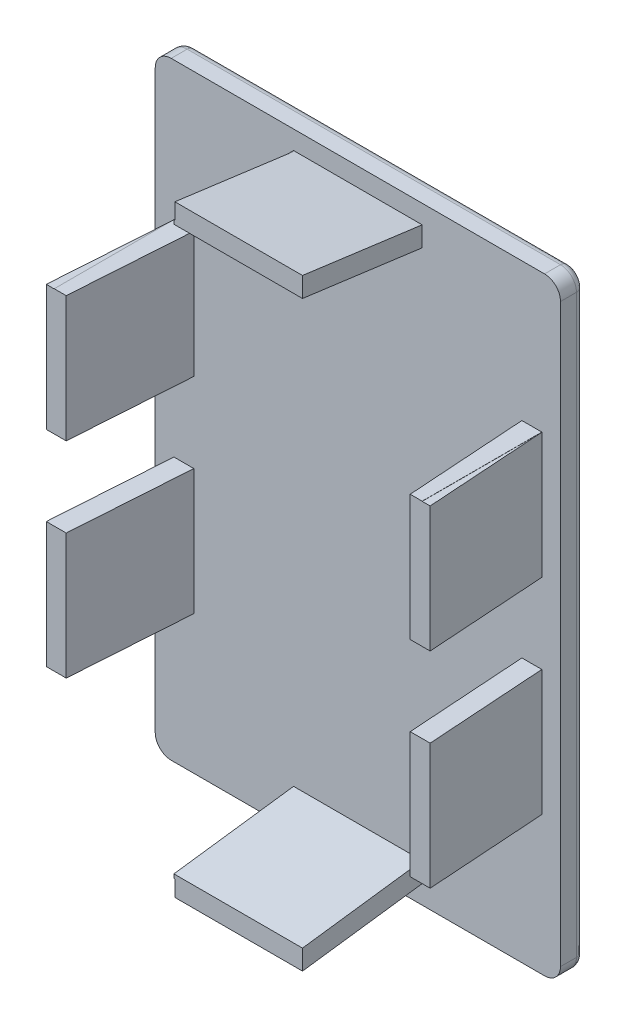
from build123d import *

# Parameters (mm, degrees)
CROQUIS1_W              = 50.8
CROQUIS1_H              = 76.2
SALIENTE_EXTRUIR1_DEPTH = 18
CROQUIS2_W              = 50.8
CROQUIS2_H              = 76.2
CROQUIS2_W_2            = 46.12
CROQUIS2_H_2            = 71.52
CROQUIS2_W_3            = 38.8
CROQUIS2_H_3            = 64.2
CORTAR_EXTRUIR1_DEPTH   = 15
CORTAR_EXTRUIR8_DEPTH   = 15
SALIENTE_EXTRUIR3_DEPTH = 41.5
CORTAR_EXTRUIR9_DEPTH   = 51.5
CORTAR_EXTRUIR10_DEPTH  = 51.5
SALIENTE_EXTRUIR4_DEPTH = 16
CORTAR_EXTRUIR11_DEPTH  = 16.5
REDONDEO3_R             = 2
REDONDEO4_R             = 1
CROQUIS15_W             = 48.12
CROQUIS15_H             = 10
CORTAR_EXTRUIR12_DEPTH  = 15
CROQUIS16_W             = 8
CROQUIS16_H             = 1.5
CORTAR_EXTRUIR13_DEPTH  = 2


with BuildPart() as part:
    # Croquis1 → Saliente-Extruir1 (new body)
    with BuildSketch(Plane.XY):
        Rectangle(CROQUIS1_W, CROQUIS1_H)
    extrude(amount=SALIENTE_EXTRUIR1_DEPTH)

    # Croquis2 → Cortar-Extruir1 (cut)
    # profile 1 of 2: a face of its own
    with BuildSketch(Plane.XY.offset(18)):
        Rectangle(CROQUIS2_W, CROQUIS2_H)
        Rectangle(CROQUIS2_W_2, CROQUIS2_H_2, mode=Mode.SUBTRACT)
    # profile 2 of 2: a face of its own
    with BuildSketch(Plane.XY.offset(18)):
        Rectangle(CROQUIS2_W_3, CROQUIS2_H_3)
    extrude(amount=-CORTAR_EXTRUIR1_DEPTH, mode=Mode.SUBTRACT)

    # Croquis6 → Cortar-Extruir8 (cut)
    with BuildSketch(Plane.XY.offset(18)):
        Polygon((-23.06, 35.76), (-8.06, 35.76), (-8.06, 32.1), (-19.4, 32.1), (-19.4, 20.76), (-23.06, 20.76), align=None)
        Polygon((23.06, 35.76), (8.06, 35.76), (8.06, 32.1), (19.4, 32.1), (19.4, 20.76), (23.06, 20.76), align=None)
        Polygon((-23.06, -35.76), (-23.06, -20.76), (-19.4, -20.76), (-19.4, -32.1), (-8.06, -32.1), (-8.06, -35.76), align=None)
        Polygon((23.06, -35.76), (8.06, -35.76), (8.06, -32.1), (19.4, -32.1), (19.4, -20.76), (23.06, -20.76), align=None)
    extrude(amount=-CORTAR_EXTRUIR8_DEPTH, mode=Mode.SUBTRACT)

    # Croquis10 → Saliente-Extruir3 (add)
    with BuildSketch(Plane(origin=(0, -20.76, 0), x_dir=(-1, 0, 0), z_dir=(0, -1, 0))):
        Polygon((23.06, -18), (24.06, -18), (23.06, -3), align=None)
        Polygon((-23.06, -18), (-24.06, -18), (-23.06, -3), align=None)
    extrude(amount=-SALIENTE_EXTRUIR3_DEPTH)

    # Croquis11 → Cortar-Extruir9 (cut)
    with BuildSketch(Plane.XZ.offset(20.76)):
        Polygon((-19.4, 18), (-21.56, 18), (-20.56, 3), (-19.4, 3), align=None)
    extrude(amount=-CORTAR_EXTRUIR9_DEPTH, mode=Mode.SUBTRACT)

    # Croquis12 → Cortar-Extruir10 (cut)
    with BuildSketch(Plane.XZ.offset(20.76)):
        Polygon((19.4, 18), (19.4, 3), (20.56, 3), (21.56, 18), align=None)
    extrude(amount=-CORTAR_EXTRUIR10_DEPTH, mode=Mode.SUBTRACT)

    # Croquis13 → Saliente-Extruir4 (add)
    with BuildSketch(Plane(origin=(8.06, 0, 0), x_dir=(0, 0, -1), z_dir=(1, 0, 0))):
        Polygon((-18, -35.76), (-18, -37.76), (-3, -35.76), align=None)
        Polygon((-18, 35.76), (-18, 37.76), (-3, 35.76), align=None)
    extrude(amount=-SALIENTE_EXTRUIR4_DEPTH)

    # Croquis14 → Cortar-Extruir11 (cut)
    with BuildSketch(Plane(origin=(8.06, 0, 0), x_dir=(0, 0, -1), z_dir=(1, 0, 0))):
        Polygon((-3, -32.1), (-18, -32.1), (-18, -35.26), (-3, -33.26), align=None)
        Polygon((-18, 32.1), (-18, 35.26), (-3, 33.26), (-3, 32.1), align=None)
    extrude(amount=-CORTAR_EXTRUIR11_DEPTH, mode=Mode.SUBTRACT)

    # Redondeo3
    redondeo3_edges = [part.edges().sort_by_distance(p)[0] for p in [
        (-25.4, 38.1, 1.5),
        (25.4, 38.1, 1.5),
        (25.4, -38.1, 1.5),
        (-25.4, -38.1, 1.5),
    ]]
    fillet(redondeo3_edges, radius=REDONDEO3_R)

    # Redondeo4
    redondeo4_edges = [part.edges().sort_by_distance(p)[0] for p in [
        (0, 38.1, 0),
        (-25.4, 0, 0),
        (25.4, 0, 0),
        (0, -38.1, 0),
        (24.814213562, -37.514213562, 0),
        (-24.814213562, -37.514213562, 0),
        (-24.814213562, 37.514213562, 0),
        (24.814213562, 37.514213562, 0),
    ]]
    fillet(redondeo4_edges, radius=REDONDEO4_R)

    # Croquis15 → Cortar-Extruir12 (cut)
    with BuildSketch(Plane.XY.offset(18)):
        with Locations((0, -0.01)):
            Rectangle(CROQUIS15_W, CROQUIS15_H)
    extrude(amount=-CORTAR_EXTRUIR12_DEPTH, mode=Mode.SUBTRACT)

    # Croquis16 → Cortar-Extruir13 (cut)
    with BuildSketch(Plane.XZ.offset(38.1)):
        with Locations((0, 2.25)):
            Rectangle(CROQUIS16_W, CROQUIS16_H)
    extrude(amount=-CORTAR_EXTRUIR13_DEPTH, mode=Mode.SUBTRACT)


solid = part.part
